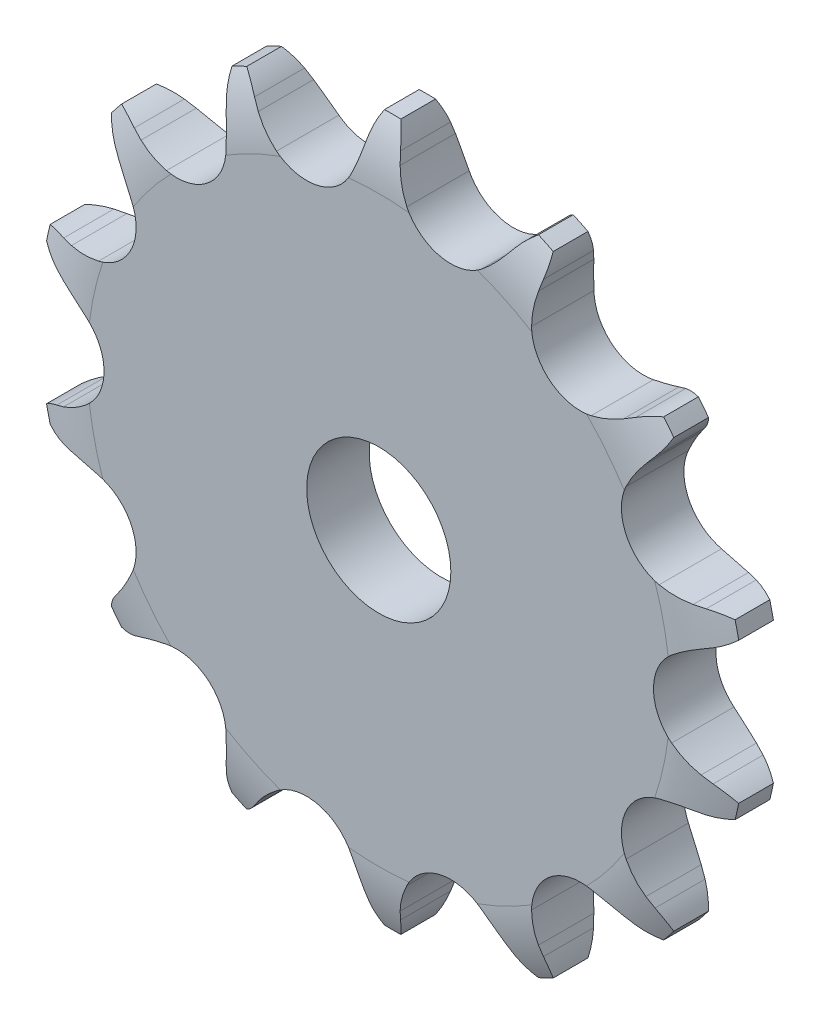
from build123d import *

# Parameters (mm, degrees)
CUT_EXTRUDE1_DEPTH      = 22.173753371
CIRPATTERN1_COUNT       = 14
BOSS_EXTRUDE1_START     = 1.3
SKETCH2_R               = 10
BOSS_EXTRUDE1_DEPTH     = 7.4
CUT_EXTRUDE2_DEPTH      = 23.638763165
CUT_EXTRUDE2_DEPTH_BACK = 23.638763165
SKETCH3_R               = 3
SKETCH4_W               = 1.95
SKETCH4_H               = 5.561981181
CUT_EXTRUDE3_DEPTH      = 23.638763165
CUT_EXTRUDE3_DEPTH_BACK = 23.638763165
SKETCH5_OUTSIDE_W       = 39.82
SKETCH5_OUTSIDE_H       = 40.484
SKETCH5_OUTSIDE_R       = 14.7
SKETCH6_R               = 11.192033986
CUT_EXTRUDE4_DEPTH      = 10


with BuildPart() as part:
    # Sketch1 → Revolve1 (revolve)
    with BuildSketch(Plane(origin=(0, 0, 0), x_dir=(0, 0, -1), z_dir=(1, 0, 0))):
        with BuildLine():
            Line((1.3, 0), (-1.3, 0))
            Line((-1.3, 0), (-1.3, 12.131386581))
            ThreePointArc((-1.3, 12.131386581), (-1.122370651, 13.580524255), (-0.6, 14.943858803))
            Line((-0.6, 14.943858803), (0.6, 14.943858803))
            ThreePointArc((0.6, 14.943858803), (1.122370651, 13.580524255), (1.3, 12.131386581))
            Line((1.3, 12.131386581), (1.3, 0))
        make_face()
    revolve(axis=Axis((0, 0, -1.3), (0, 0, 1)))

    # Sketch0 → Cut-Extrude1 (cut, symmetric)
    with BuildSketch(Plane.XY):
        with BuildLine():
            Line((5.429921733, -12.768087969), (5.163666973, -12.429043279))
            ThreePointArc((5.163666973, -12.429043279), (4.737879573, -11.950189307), (4.256908309, -11.526795071))
            ThreePointArc((4.256908309, -11.526795071), (2.544254875, -11.147108946), (1.165947085, -12.2322868))
            ThreePointArc((1.165947085, -12.2322868), (0.916310824, -12.822437436), (0.740456585, -13.438612186))
            Line((0.740456585, -13.438612186), (0.647675313, -13.859604507))
            ThreePointArc((0.647675313, -13.859604507), (-0.779451529, -15.926894935), (-3.2453378, -16.406254544))
            ThreePointArc((-3.2453378, -16.406254544), (3.721474891, -16.304846833), (10.042355391, -13.373425284))
            ThreePointArc((10.042355391, -13.373425284), (7.612682289, -14.011445155), (5.429921733, -12.768087969))
        make_face()
    cut_extrude1 = extrude(amount=CUT_EXTRUDE1_DEPTH, both=True, mode=Mode.SUBTRACT)

    # CirPattern1: Cut-Extrude1 ×14 about axis
    cirpattern1_axis = Axis((0, 0, 0), (0, 0, 1))
    for i in range(1, CIRPATTERN1_COUNT):
        add(cut_extrude1.rotate(cirpattern1_axis, i * 360 / CIRPATTERN1_COUNT), mode=Mode.SUBTRACT)

    # Sketch2 → Boss-Extrude1 (add)
    with BuildSketch(Plane.XY.offset(BOSS_EXTRUDE1_START)):
        with Locations(Location((0, 0, 0), (0, 0, 270))):
            Circle(SKETCH2_R)
    extrude(amount=BOSS_EXTRUDE1_DEPTH)

    # Sketch3 → Cut-Extrude2 (cut, two sides: drawn at the far end of the back side and taken through both)
    with BuildSketch(Plane.XY.offset(-CUT_EXTRUDE2_DEPTH_BACK)):
        Circle(SKETCH3_R)
    extrude(amount=CUT_EXTRUDE2_DEPTH + CUT_EXTRUDE2_DEPTH_BACK, mode=Mode.SUBTRACT)

    # Sketch4 → Cut-Revolve1 (revolve, cut)
    with BuildSketch(Plane(origin=(0, 0, 0), x_dir=(0, 0, -1), z_dir=(1, 0, 0))):
        Polygon((-8.7, 10), (-8.7, 9.5), (-8.2, 10), align=None)
        with Locations((-2.275, 12.162868213)):
            Rectangle(SKETCH4_W, SKETCH4_H)
    revolve(axis=Axis((0, 0, -1.3), (0, 0, 1)), mode=Mode.SUBTRACT)

    # Sketch5 outside → Cut-Extrude3 (cut, two sides: drawn at the far end of the back side and taken through both)
    with BuildSketch(Plane.XY.offset(-CUT_EXTRUDE3_DEPTH_BACK)):
        Rectangle(SKETCH5_OUTSIDE_W, SKETCH5_OUTSIDE_H)
        Circle(SKETCH5_OUTSIDE_R, mode=Mode.SUBTRACT)
    extrude(amount=CUT_EXTRUDE3_DEPTH + CUT_EXTRUDE3_DEPTH_BACK, mode=Mode.SUBTRACT)

    # Sketch6 → Cut-Extrude4 (cut)
    with BuildSketch(Plane.XY.offset(1.3)):
        Circle(SKETCH6_R)
    extrude(amount=CUT_EXTRUDE4_DEPTH, mode=Mode.SUBTRACT)


solid = part.part
